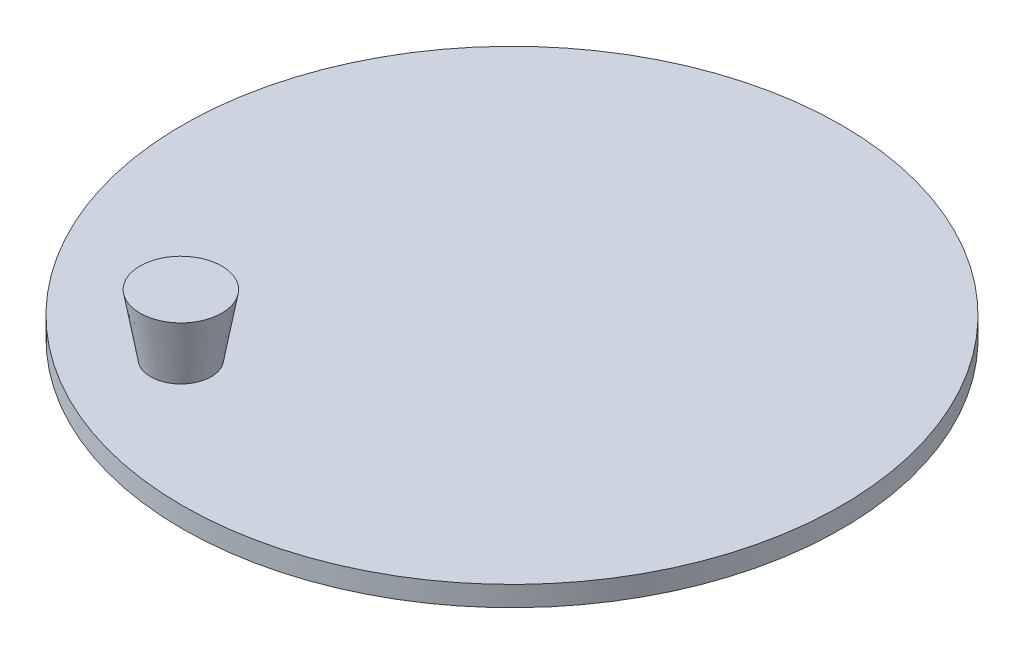
from build123d import *

# Parameters (mm, degrees)
SKETCH1_R           = 16.35
BOSS_EXTRUDE1_DEPTH = 1
SKETCH2_R           = 1.498431706
BOSS_EXTRUDE2_DEPTH = 3
BOSS_EXTRUDE2_DRAFT = -10


with BuildPart() as part:
    # Sketch1 → Boss-Extrude1 (new body)
    with BuildSketch(Plane(origin=(0, 0, 0), x_dir=(1, 0, 0), z_dir=(0, 1, 0))):
        with Locations(Location((0, 0, 0), (0, 0, 270))):
            Circle(SKETCH1_R)
    extrude(amount=BOSS_EXTRUDE1_DEPTH)


with BuildPart() as boss_extrude2_tool:
    # Sketch2 → Boss-Extrude2 (with draft: the straight prism first)
    with BuildSketch(Plane(origin=(0, 1, 0), x_dir=(1, 0, 0), z_dir=(0, 1, 0))):
        with Locations((-6.321685986, -10.105513291)):
            Circle(SKETCH2_R)
    extrude(amount=BOSS_EXTRUDE2_DEPTH)
    # Boss-Extrude2: the draft: its side faces are tilted about the plane it starts from
    boss_extrude2_sides = [boss_extrude2_tool.faces().sort_by_distance(p)[0] for p in [
        (-7.820117692, 2.5, 10.105513291),
    ]]
    draft(boss_extrude2_sides, Plane(origin=(0, 1, 0), x_dir=(1, 0, 0), z_dir=(0, 1, 0)), BOSS_EXTRUDE2_DRAFT)


with BuildPart() as part_1:
    add(part.part)

    # Boss-Extrude2: add boss_extrude2_tool
    add(boss_extrude2_tool.part)


solid = part_1.part
